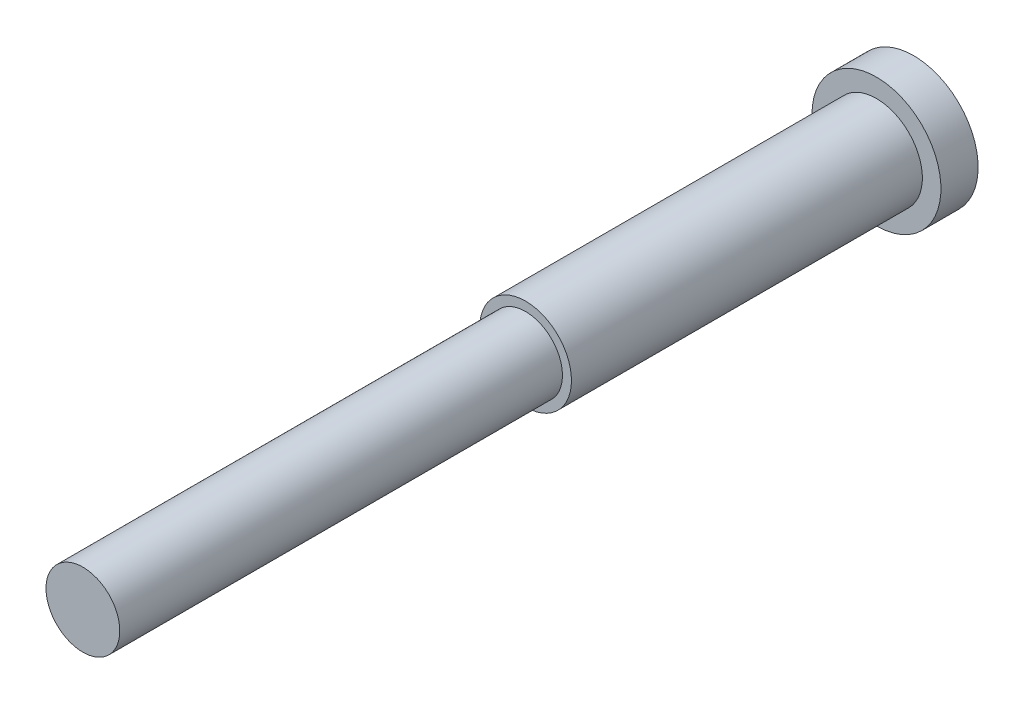
from build123d import *

# Parameters (mm, degrees)
SKETCH1_R           = 7.9
BASE_EXTRUDE_DEPTH  = 60.4
SKETCH2_R           = 6.35
BOSS_EXTRUDE1_DEPTH = 76.2
SKETCH3_R           = 11.1
BOSS_EXTRUDE2_DEPTH = 6.4


with BuildPart() as part:
    # Sketch1 → Base-Extrude (new body)
    with BuildSketch(Plane.XY):
        Circle(SKETCH1_R)
    extrude(amount=BASE_EXTRUDE_DEPTH)

    # Sketch2 → Boss-Extrude1 (add)
    with BuildSketch(Plane.XY.offset(60.4)):
        with Locations(Location((0, 0, 0), (0, 0, 180))):
            Circle(SKETCH2_R)
    extrude(amount=BOSS_EXTRUDE1_DEPTH)

    # Sketch3 → Boss-Extrude2 (add)
    with BuildSketch(Plane(origin=(0, 0, 0), x_dir=(-1, 0, 0), z_dir=(0, 0, -1))):
        Circle(SKETCH3_R)
    extrude(amount=BOSS_EXTRUDE2_DEPTH)


solid = part.part
